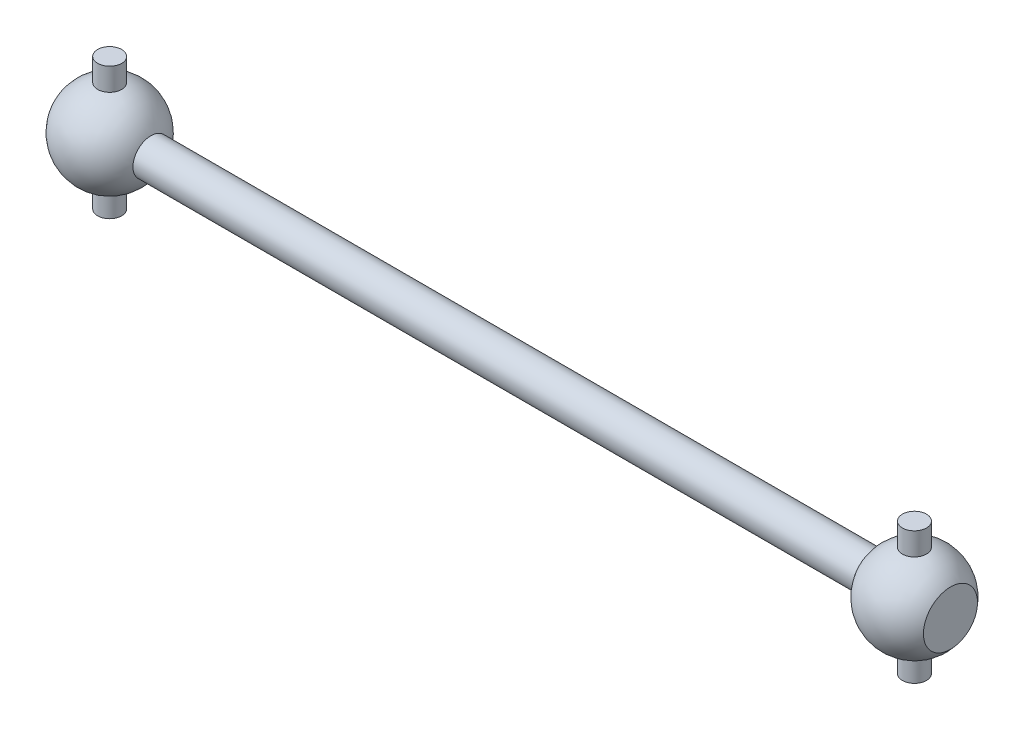
from build123d import *

# Parameters (mm, degrees)
SKETCH_2_R      = 2
EXTRUDE_1_DEPTH = 11


with BuildPart() as part:
    # 草图1 → 旋转1 (revolve)
    with BuildSketch(Plane.XY):
        with BuildLine():
            Line((73, 0), (73, 4.5))
            ThreePointArc((73, 4.5), (66.132008426, 7.449603387), (60.126136458, 3))
            Line((60.126136458, 3), (-60.126136458, 3))
            ThreePointArc((-60.126136458, 3), (-66.132008426, 7.449603387), (-73, 4.5))
            Line((-73, 4.5), (-73, 0))
            Line((-73, 0), (73, 0))
        make_face()
    revolve(axis=Axis((-104.662512522, 0, 0), (1, 0, 0)))

    # 草图2 → 凸台-拉伸1 (add, symmetric)
    with BuildSketch(Plane(origin=(0, 0, 0), x_dir=(1, 0, 0), z_dir=(0, 1, 0))):
        with Locations(Location((67, 0, 0), (0, 0, 90))):
            Circle(SKETCH_2_R)
    extrude_1 = extrude(amount=EXTRUDE_1_DEPTH, both=True)

    # 镜向1: 凸台-拉伸1 across plane
    add(extrude_1.mirror(Plane(origin=(0, 0, 0), x_dir=(0, 0, 1), z_dir=(1, 0, 0))))


solid = part.part
